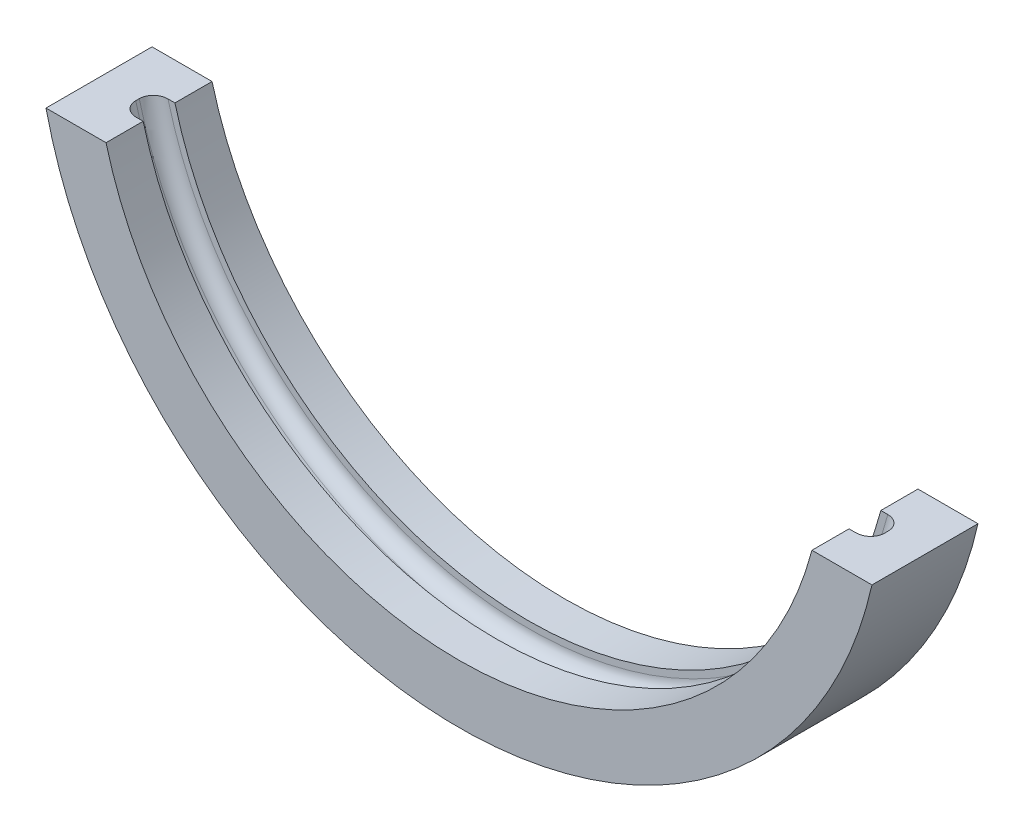
from build123d import *

# Parameters (mm, degrees)
BOSS_EXTRUDE1_DEPTH = 5.715
BOSS_EXTRUDE2_DEPTH = 6.6675
BOSS_EXTRUDE3_START = 6.6675
BOSS_EXTRUDE3_DEPTH = 6.6675
FILLET1_R           = 2.54
SKETCH5_R           = 1.524
CUT_EXTRUDE1_DEPTH  = 6.35
CUT_EXTRUDE2_DEPTH  = 110.257060148


with BuildPart() as part:
    # Sketch1 → Boss-Extrude1 (new body)
    with BuildSketch(Plane.XY):
        with BuildLine():
            ThreePointArc((69.342, 76.073), (0, 6.731), (-69.342, 76.073))
            Line((-69.342, 76.073), (-76.073, 76.073))
            ThreePointArc((-76.073, 76.073), (0, 0), (76.073, 76.073))
            Line((76.073, 76.073), (69.342, 76.073))
        make_face()
    extrude(amount=BOSS_EXTRUDE1_DEPTH)

    # Sketch3 → Boss-Extrude2 (add)
    with BuildSketch(Plane.XY.offset(5.715)):
        with BuildLine():
            ThreePointArc((65.5955, 76.073), (0, 10.4775), (-65.5955, 76.073))
            Line((-65.5955, 76.073), (-69.342, 76.073))
            ThreePointArc((-69.342, 76.073), (0, 6.731), (69.342, 76.073))
            Line((69.342, 76.073), (65.5955, 76.073))
        make_face()
        with BuildLine():
            Line((76.073, 76.073), (69.342, 76.073))
            ThreePointArc((69.342, 76.073), (0, 6.731), (-69.342, 76.073))
            Line((-69.342, 76.073), (-76.073, 76.073))
            ThreePointArc((-76.073, 76.073), (0, 0), (76.073, 76.073))
        make_face()
    extrude(amount=BOSS_EXTRUDE2_DEPTH)

    # Sketch4 → Boss-Extrude3 (add)
    with BuildSketch(Plane(origin=(0, 0, 0), x_dir=(-1, 0, 0), z_dir=(0, 0, -1)).offset(BOSS_EXTRUDE3_START)):
        with BuildLine():
            ThreePointArc((65.5955, 76.073), (0, 10.4775), (-65.5955, 76.073))
            Line((-65.5955, 76.073), (-69.342, 76.073))
            ThreePointArc((-69.342, 76.073), (0, 6.731), (69.342, 76.073))
            Line((69.342, 76.073), (65.5955, 76.073))
        make_face()
        with BuildLine():
            Line((76.073, 76.073), (69.342, 76.073))
            ThreePointArc((69.342, 76.073), (0, 6.731), (-69.342, 76.073))
            Line((-69.342, 76.073), (-76.073, 76.073))
            ThreePointArc((-76.073, 76.073), (0, 0), (76.073, 76.073))
        make_face()
    extrude(amount=-BOSS_EXTRUDE3_DEPTH)

    # Fillet1
    fillet1_edges = [part.edges().sort_by_distance(p)[0] for p in [
        (0, 6.731, 5.715),
        (0, 6.731, 0),
    ]]
    fillet(fillet1_edges, radius=FILLET1_R)

    # Sketch5 → Cut-Extrude1 (cut)
    with BuildSketch(Plane(origin=(0, 0, 0), x_dir=(1, 0, 0), z_dir=(0, 1, 0))):
        with Locations(Location((0, -2.8575, 0), (0, 0, 90))):
            Circle(SKETCH5_R)
    extrude(amount=CUT_EXTRUDE1_DEPTH, mode=Mode.SUBTRACT)

    # Sketch6 → Cut-Extrude2 (cut, through all)
    with BuildSketch(Plane.XY.offset(12.3825)):
        with BuildLine():
            ThreePointArc((-76.073, 76.073), (-75.604028212, 67.639006454), (-74.202895045, 59.309))
            Line((-74.202895045, 59.309), (-63.417173733, 59.309))
            ThreePointArc((-63.417173733, 59.309), (-65.048638878, 67.620532885), (-65.5955, 76.073))
            Line((-65.5955, 76.073), (-76.073, 76.073))
        make_face()
        with BuildLine():
            ThreePointArc((74.202895045, 59.309), (75.604028212, 67.639006454), (76.073, 76.073))
            Line((76.073, 76.073), (65.5955, 76.073))
            ThreePointArc((65.5955, 76.073), (65.048638878, 67.620532885), (63.417173733, 59.309))
            Line((63.417173733, 59.309), (74.202895045, 59.309))
        make_face()
    extrude(amount=-CUT_EXTRUDE2_DEPTH, mode=Mode.SUBTRACT)


solid = part.part
